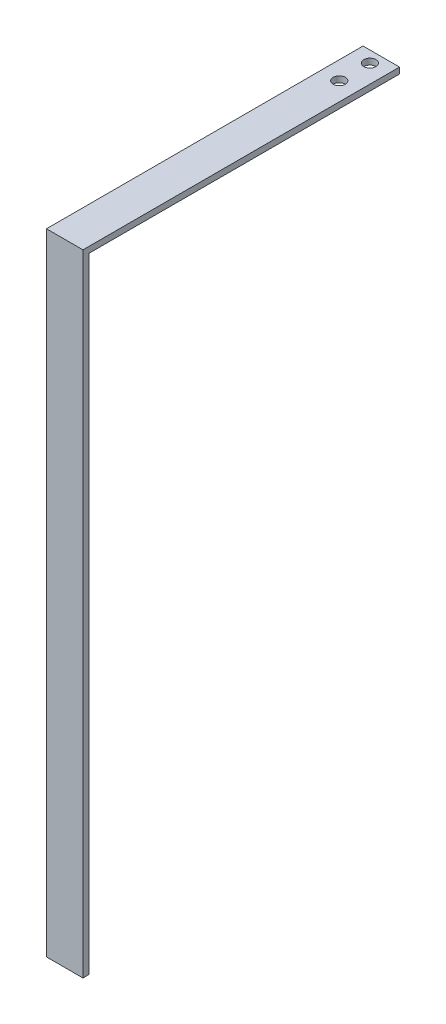
from build123d import *

# Parameters (mm, degrees)
CROQUIS1_W              = 38.1
CROQUIS1_H              = 6.31
SALIENTE_EXTRUIR1_DEPTH = 330.7
CROQUIS3_W              = 38.1
CROQUIS3_H              = 6.31
SALIENTE_EXTRUIR2_DEPTH = 652.48
CROQUIS5_R              = 6.35
CORTAR_EXTRUIR1_DEPTH   = 6.31


with BuildPart() as part:
    # Croquis1 → Saliente-Extruir1 (new body)
    with BuildSketch(Plane.XY):
        Rectangle(CROQUIS1_W, CROQUIS1_H)
    extrude(amount=SALIENTE_EXTRUIR1_DEPTH)

    # Croquis3 → Saliente-Extruir2 (add)
    with BuildSketch(Plane.XZ.offset(3.155)):
        with Locations((0, 327.545)):
            Rectangle(CROQUIS3_W, CROQUIS3_H)
    extrude(amount=SALIENTE_EXTRUIR2_DEPTH)

    # Croquis5 → Cortar-Extruir1 (cut)
    with BuildSketch(Plane(origin=(0, 3.155, 0), x_dir=(1, 0, 0), z_dir=(0, 1, 0))):
        with Locations(Location((0, -43.892204666, 0), (0, 0, 270))):
            Circle(CROQUIS5_R)
        with Locations(Location((0, -11.892204666, 0), (0, 0, 270))):
            Circle(CROQUIS5_R)
    extrude(amount=-CORTAR_EXTRUIR1_DEPTH, mode=Mode.SUBTRACT)


solid = part.part
